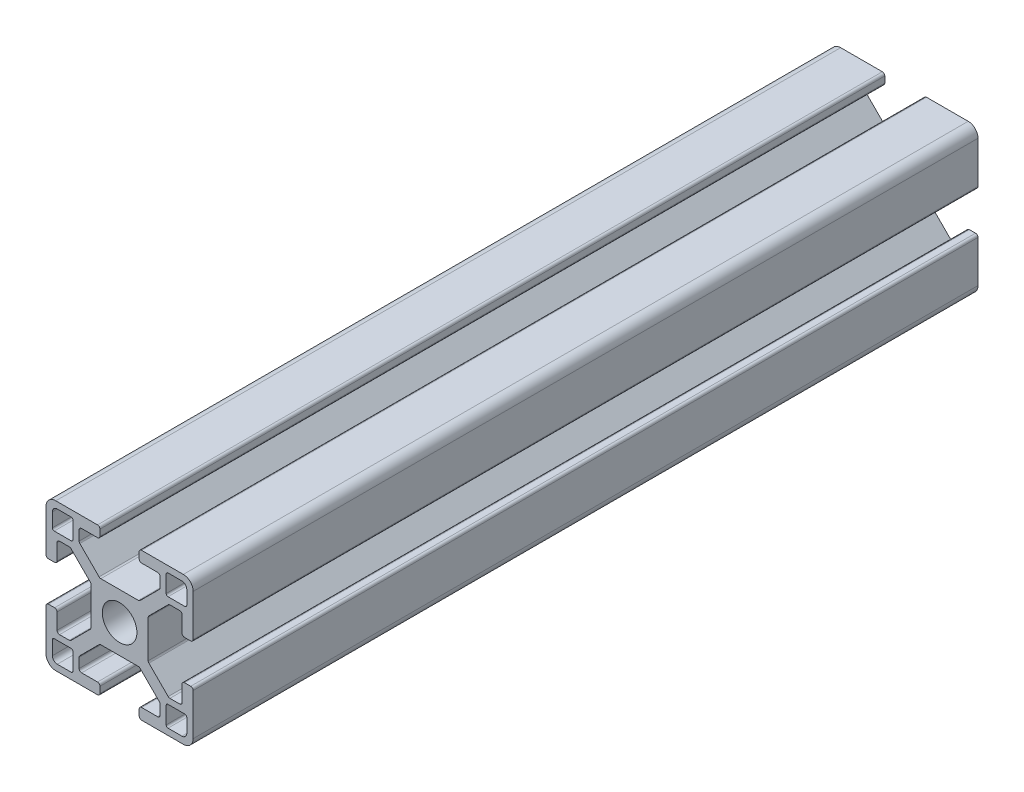
from build123d import *

# Parameters (mm, degrees)
SKETCH1_R           = 3.52998588
BOSS_EXTRUDE1_DEPTH = 80


with BuildPart() as part:
    # Sketch1 → Boss-Extrude1 (new, symmetric)
    with BuildSketch(Plane.XY):
        with BuildLine():
            Line((14.49994, -4), (13.24247465, -4))
            ThreePointArc((13.24247465, -4), (12.88892126, -4.146446609), (12.74247465, -4.5))
            Line((12.74247465, -4.5), (12.74247465, -7.732519321))
            ThreePointArc((12.74247465, -7.732519321), (12.602449697, -8.097296796), (12.242781236, -8.249967))
            Line((12.242781236, -8.249967), (10.260188032, -8.249967))
            ThreePointArc((10.260188032, -8.249967), (10.068847082, -8.211906919), (9.906636056, -8.103520976))
            Line((9.906636056, -8.103520976), (5.981117769, -4.178002689))
            ThreePointArc((5.981117769, -4.178002689), (5.872731827, -4.015791664), (5.834671745, -3.824450713))
            Line((5.834671745, -3.824450713), (5.834671745, -1.01249595))
            Line((5.834671745, -1.01249595), (5.834671745, 0.88749645))
            Line((5.834671745, 0.88749645), (5.834671745, 3.824450713))
            ThreePointArc((5.834671745, 3.824450713), (5.872731827, 4.015791664), (5.981117769, 4.178002689))
            Line((5.981117769, 4.178002689), (9.906636056, 8.103520976))
            ThreePointArc((9.906636056, 8.103520976), (10.068847082, 8.211906919), (10.260188032, 8.249967))
            Line((10.260188032, 8.249967), (12.242781236, 8.249967))
            ThreePointArc((12.242781236, 8.249967), (12.602449697, 8.097296796), (12.74247465, 7.732519321))
            Line((12.74247465, 7.732519321), (12.74247465, 4.5))
            ThreePointArc((12.74247465, 4.5), (12.88892126, 4.146446609), (13.24247465, 4))
            Line((13.24247465, 4), (14.49994, 4))
            ThreePointArc((14.49994, 4), (14.853493391, 4.146446609), (14.99994, 4.5))
            Line((14.99994, 4.5), (14.99994, 12.999948))
            ThreePointArc((14.99994, 12.999948), (14.414155906, 14.414155906), (12.999948, 14.99994))
            Line((12.999948, 14.99994), (4.5, 14.99994))
            ThreePointArc((4.5, 14.99994), (4.146446609, 14.853493391), (4, 14.49994))
            Line((4, 14.49994), (4, 13.24247465))
            ThreePointArc((4, 13.24247465), (4.146446609, 12.88892126), (4.5, 12.74247465))
            Line((4.5, 12.74247465), (7.732519321, 12.74247465))
            ThreePointArc((7.732519321, 12.74247465), (8.097296796, 12.602449697), (8.249967, 12.242781236))
            Line((8.249967, 12.242781236), (8.249967, 10.260188032))
            ThreePointArc((8.249967, 10.260188032), (8.211906919, 10.068847082), (8.103520976, 9.906636056))
            Line((8.103520976, 9.906636056), (4.178002689, 5.981117769))
            ThreePointArc((4.178002689, 5.981117769), (4.015791664, 5.872731827), (3.824450713, 5.834671745))
            Line((3.824450713, 5.834671745), (0.9499962, 5.834671745))
            Line((0.9499962, 5.834671745), (-0.9499962, 5.834671745))
            Line((-0.9499962, 5.834671745), (-3.824450713, 5.834671745))
            ThreePointArc((-3.824450713, 5.834671745), (-4.015791664, 5.872731827), (-4.178002689, 5.981117769))
            Line((-4.178002689, 5.981117769), (-8.103520976, 9.906636056))
            ThreePointArc((-8.103520976, 9.906636056), (-8.211906919, 10.068847082), (-8.249967, 10.260188032))
            Line((-8.249967, 10.260188032), (-8.249967, 12.242781236))
            ThreePointArc((-8.249967, 12.242781236), (-8.097296796, 12.602449697), (-7.732519321, 12.74247465))
            Line((-7.732519321, 12.74247465), (-4.5, 12.74247465))
            ThreePointArc((-4.5, 12.74247465), (-4.146446609, 12.88892126), (-4, 13.24247465))
            Line((-4, 13.24247465), (-4, 14.49994))
            ThreePointArc((-4, 14.49994), (-4.146446609, 14.853493391), (-4.5, 14.99994))
            Line((-4.5, 14.99994), (-12.999948, 14.99994))
            ThreePointArc((-12.999948, 14.99994), (-14.414155906, 14.414155906), (-14.99994, 12.999948))
            Line((-14.99994, 12.999948), (-14.99994, 4.5))
            ThreePointArc((-14.99994, 4.5), (-14.853493391, 4.146446609), (-14.49994, 4))
            Line((-14.49994, 4), (-13.24247465, 4))
            ThreePointArc((-13.24247465, 4), (-12.88892126, 4.146446609), (-12.74247465, 4.5))
            Line((-12.74247465, 4.5), (-12.74247465, 7.732519321))
            ThreePointArc((-12.74247465, 7.732519321), (-12.602449697, 8.097296796), (-12.242781236, 8.249967))
            Line((-12.242781236, 8.249967), (-10.260188032, 8.249967))
            ThreePointArc((-10.260188032, 8.249967), (-10.068847082, 8.211906919), (-9.906636056, 8.103520976))
            Line((-9.906636056, 8.103520976), (-5.981117769, 4.178002689))
            ThreePointArc((-5.981117769, 4.178002689), (-5.872731827, 4.015791664), (-5.834671745, 3.824450713))
            Line((-5.834671745, 3.824450713), (-5.834671745, 0.88749645))
            Line((-5.834671745, 0.88749645), (-5.834671745, -1.01249595))
            Line((-5.834671745, -1.01249595), (-5.834671745, -3.824450713))
            ThreePointArc((-5.834671745, -3.824450713), (-5.872731827, -4.015791664), (-5.981117769, -4.178002689))
            Line((-5.981117769, -4.178002689), (-9.906636056, -8.103520976))
            ThreePointArc((-9.906636056, -8.103520976), (-10.068847082, -8.211906919), (-10.260188032, -8.249967))
            Line((-10.260188032, -8.249967), (-12.242781236, -8.249967))
            ThreePointArc((-12.242781236, -8.249967), (-12.602449697, -8.097296796), (-12.74247465, -7.732519321))
            Line((-12.74247465, -7.732519321), (-12.74247465, -4.5))
            ThreePointArc((-12.74247465, -4.5), (-12.88892126, -4.146446609), (-13.24247465, -4))
            Line((-13.24247465, -4), (-14.49994, -4))
            ThreePointArc((-14.49994, -4), (-14.853493391, -4.146446609), (-14.99994, -4.5))
            Line((-14.99994, -4.5), (-14.99994, -12.999948))
            ThreePointArc((-14.99994, -12.999948), (-14.414155906, -14.414155906), (-12.999948, -14.99994))
            Line((-12.999948, -14.99994), (-4.5, -14.99994))
            ThreePointArc((-4.5, -14.99994), (-4.146446609, -14.853493391), (-4, -14.49994))
            Line((-4, -14.49994), (-4, -13.24247465))
            ThreePointArc((-4, -13.24247465), (-4.146446609, -12.88892126), (-4.5, -12.74247465))
            Line((-4.5, -12.74247465), (-7.732519321, -12.74247465))
            ThreePointArc((-7.732519321, -12.74247465), (-8.097296796, -12.602449697), (-8.249967, -12.242781236))
            Line((-8.249967, -12.242781236), (-8.249967, -10.260188032))
            ThreePointArc((-8.249967, -10.260188032), (-8.211906919, -10.068847082), (-8.103520976, -9.906636056))
            Line((-8.103520976, -9.906636056), (-4.178002689, -5.981117769))
            ThreePointArc((-4.178002689, -5.981117769), (-4.015791664, -5.872731827), (-3.824450713, -5.834671745))
            Line((-3.824450713, -5.834671745), (-0.9499962, -5.834671745))
            Line((-0.9499962, -5.834671745), (0.9499962, -5.834671745))
            Line((0.9499962, -5.834671745), (3.824450713, -5.834671745))
            ThreePointArc((3.824450713, -5.834671745), (4.015791664, -5.872731827), (4.178002689, -5.981117769))
            Line((4.178002689, -5.981117769), (8.103520976, -9.906636056))
            ThreePointArc((8.103520976, -9.906636056), (8.211906919, -10.068847082), (8.249967, -10.260188032))
            Line((8.249967, -10.260188032), (8.249967, -12.242781236))
            ThreePointArc((8.249967, -12.242781236), (8.097296796, -12.602449697), (7.732519321, -12.74247465))
            Line((7.732519321, -12.74247465), (4.5, -12.74247465))
            ThreePointArc((4.5, -12.74247465), (4.146446609, -12.88892126), (4, -13.24247465))
            Line((4, -13.24247465), (4, -14.49994))
            ThreePointArc((4, -14.49994), (4.146446609, -14.853493391), (4.5, -14.99994))
            Line((4.5, -14.99994), (12.999948, -14.99994))
            ThreePointArc((12.999948, -14.99994), (14.414155906, -14.414155906), (14.99994, -12.999948))
            Line((14.99994, -12.999948), (14.99994, -4.5))
            ThreePointArc((14.99994, -4.5), (14.853493391, -4.146446609), (14.49994, -4))
        make_face()
        Circle(SKETCH1_R, mode=Mode.SUBTRACT)
        with BuildLine():
            Line((-12.6999492, -13.6999452), (-9.880960476, -13.6999452))
            ThreePointArc((-9.880960476, -13.6999452), (-9.61155387, -13.58835333), (-9.499962, -13.318946724))
            Line((-9.499962, -13.318946724), (-9.499962, -9.87996048))
            ThreePointArc((-9.499962, -9.87996048), (-9.611260978, -9.611260978), (-9.87996048, -9.499962))
            Line((-9.87996048, -9.499962), (-13.318946724, -9.499962))
            ThreePointArc((-13.318946724, -9.499962), (-13.58835333, -9.61155387), (-13.6999452, -9.880960476))
            Line((-13.6999452, -9.880960476), (-13.6999452, -12.6999492))
            ThreePointArc((-13.6999452, -12.6999492), (-13.407053153, -13.407053153), (-12.6999492, -13.6999452))
        make_face(mode=Mode.SUBTRACT)
        with BuildLine():
            Line((13.6999452, -12.6999492), (13.6999452, -9.880960476))
            ThreePointArc((13.6999452, -9.880960476), (13.58835333, -9.61155387), (13.318946724, -9.499962))
            Line((13.318946724, -9.499962), (9.87996048, -9.499962))
            ThreePointArc((9.87996048, -9.499962), (9.611260978, -9.611260978), (9.499962, -9.87996048))
            Line((9.499962, -9.87996048), (9.499962, -13.318946724))
            ThreePointArc((9.499962, -13.318946724), (9.61155387, -13.58835333), (9.880960476, -13.6999452))
            Line((9.880960476, -13.6999452), (12.6999492, -13.6999452))
            ThreePointArc((12.6999492, -13.6999452), (13.407053153, -13.407053153), (13.6999452, -12.6999492))
        make_face(mode=Mode.SUBTRACT)
        with BuildLine():
            Line((9.87996048, 9.499962), (13.318946724, 9.499962))
            ThreePointArc((13.318946724, 9.499962), (13.58835333, 9.61155387), (13.6999452, 9.880960476))
            Line((13.6999452, 9.880960476), (13.6999452, 12.6999492))
            ThreePointArc((13.6999452, 12.6999492), (13.407053153, 13.407053153), (12.6999492, 13.6999452))
            Line((12.6999492, 13.6999452), (9.880960476, 13.6999452))
            ThreePointArc((9.880960476, 13.6999452), (9.61155387, 13.58835333), (9.499962, 13.318946724))
            Line((9.499962, 13.318946724), (9.499962, 9.87996048))
            ThreePointArc((9.499962, 9.87996048), (9.611260978, 9.611260978), (9.87996048, 9.499962))
        make_face(mode=Mode.SUBTRACT)
        with BuildLine():
            Line((-13.6999452, 12.6999492), (-13.6999452, 9.880960476))
            ThreePointArc((-13.6999452, 9.880960476), (-13.58835333, 9.61155387), (-13.318946724, 9.499962))
            Line((-13.318946724, 9.499962), (-9.87996048, 9.499962))
            ThreePointArc((-9.87996048, 9.499962), (-9.611260978, 9.611260978), (-9.499962, 9.87996048))
            Line((-9.499962, 9.87996048), (-9.499962, 13.318946724))
            ThreePointArc((-9.499962, 13.318946724), (-9.61155387, 13.58835333), (-9.880960476, 13.6999452))
            Line((-9.880960476, 13.6999452), (-12.6999492, 13.6999452))
            ThreePointArc((-12.6999492, 13.6999452), (-13.407053153, 13.407053153), (-13.6999452, 12.6999492))
        make_face(mode=Mode.SUBTRACT)
    extrude(amount=BOSS_EXTRUDE1_DEPTH, both=True)


solid = part.part
